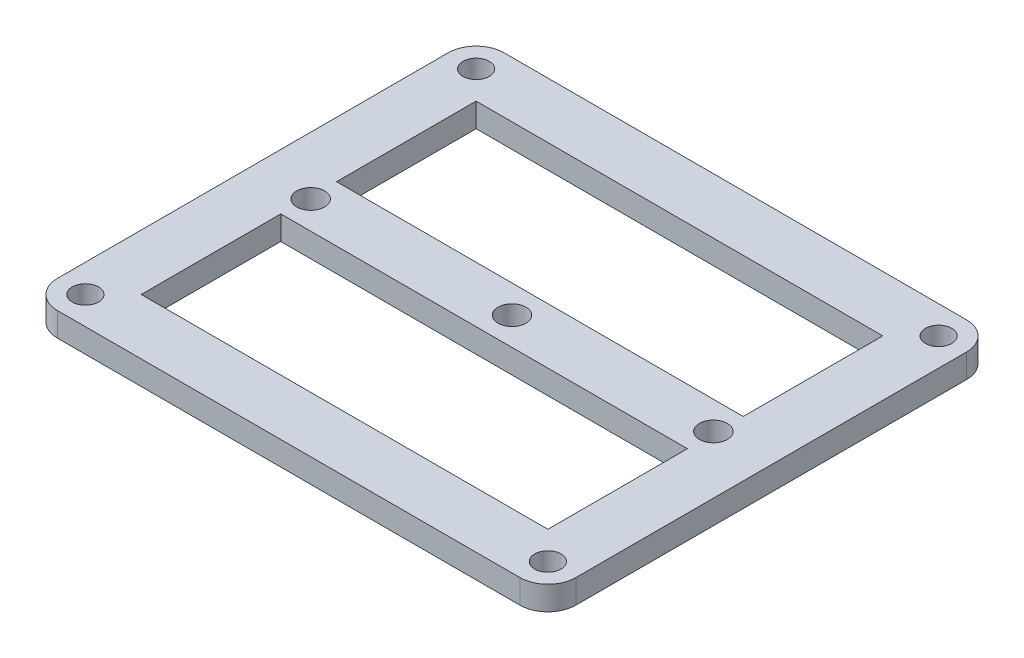
from build123d import *

# Parameters (mm, degrees)
SKETCH1_W           = 65
SKETCH1_H           = 56
SKETCH1_R           = 1.65
SKETCH1_W_2         = 51
SKETCH1_H_2         = 17.5
BOSS_EXTRUDE1_DEPTH = 3
FILLET1_R           = 3.5
CUT_EXTRUDE1_REACH  = 82.917
SKETCH2_R           = 1.75


with BuildPart() as part:
    # Sketch1 → Boss-Extrude1 (new body)
    with BuildSketch(Plane(origin=(0, 0, 0), x_dir=(1, 0, 0), z_dir=(0, 1, 0))):
        with Locations((29, 24.5)):
            Rectangle(SKETCH1_W, SKETCH1_H)
        with Locations(Location((0, 49, 0), (0, 0, 270))):
            Circle(SKETCH1_R, mode=Mode.SUBTRACT)
        with Locations(Location((58, 49, 0), (0, 0, 270))):
            Circle(SKETCH1_R, mode=Mode.SUBTRACT)
        with Locations(Location((58, 0, 0), (0, 0, 270))):
            Circle(SKETCH1_R, mode=Mode.SUBTRACT)
        with Locations(Location((0, 0, 0), (0, 0, 270))):
            Circle(SKETCH1_R, mode=Mode.SUBTRACT)
        with Locations((29, 36.75)):
            Rectangle(SKETCH1_W_2, SKETCH1_H_2, mode=Mode.SUBTRACT)
        with Locations((29, 12.25)):
            Rectangle(SKETCH1_W_2, SKETCH1_H_2, mode=Mode.SUBTRACT)
    extrude(amount=BOSS_EXTRUDE1_DEPTH)

    # Fillet1
    fillet1_edges = [part.edges().sort_by_distance(p)[0] for p in [
        (-3.5, 1.5, -52.5),
        (61.5, 1.5, -52.5),
        (61.5, 1.5, 3.5),
        (-3.5, 1.5, 3.5),
    ]]
    fillet(fillet1_edges, radius=FILLET1_R)

    # Sketch2 → Cut-Extrude1 (cut, up to next)
    with BuildSketch(Plane(origin=(0, 3, 0), x_dir=(1, 0, 0), z_dir=(0, 1, 0)), mode=Mode.PRIVATE) as cut_extrude1_sk1:
        with Locations(Location((3.75, 24.5, 0), (0, 0, 270))):
            Circle(SKETCH2_R)
    cut_extrude1_tool1 = extrude(cut_extrude1_sk1.sketch, amount=-CUT_EXTRUDE1_REACH, mode=Mode.PRIVATE) & part.part
    # Sketch2 → Cut-Extrude1 (cut, up to next)
    with BuildSketch(Plane(origin=(0, 3, 0), x_dir=(1, 0, 0), z_dir=(0, 1, 0)), mode=Mode.PRIVATE) as cut_extrude1_sk2:
        with Locations(Location((29, 24.5, 0), (0, 0, 270))):
            Circle(SKETCH2_R)
    cut_extrude1_tool2 = extrude(cut_extrude1_sk2.sketch, amount=-CUT_EXTRUDE1_REACH, mode=Mode.PRIVATE) & part.part
    # Sketch2 → Cut-Extrude1 (cut, up to next)
    with BuildSketch(Plane(origin=(0, 3, 0), x_dir=(1, 0, 0), z_dir=(0, 1, 0)), mode=Mode.PRIVATE) as cut_extrude1_sk3:
        with Locations(Location((54.25, 24.5, 0), (0, 0, 270))):
            Circle(SKETCH2_R)
    cut_extrude1_tool3 = extrude(cut_extrude1_sk3.sketch, amount=-CUT_EXTRUDE1_REACH, mode=Mode.PRIVATE) & part.part
    add(cut_extrude1_tool1.solids().sort_by_distance((3.75, 3, -24.5))[0], mode=Mode.SUBTRACT)
    add(cut_extrude1_tool2.solids().sort_by_distance((29, 3, -24.5))[0], mode=Mode.SUBTRACT)
    add(cut_extrude1_tool3.solids().sort_by_distance((54.25, 3, -24.5))[0], mode=Mode.SUBTRACT)


solid = part.part
